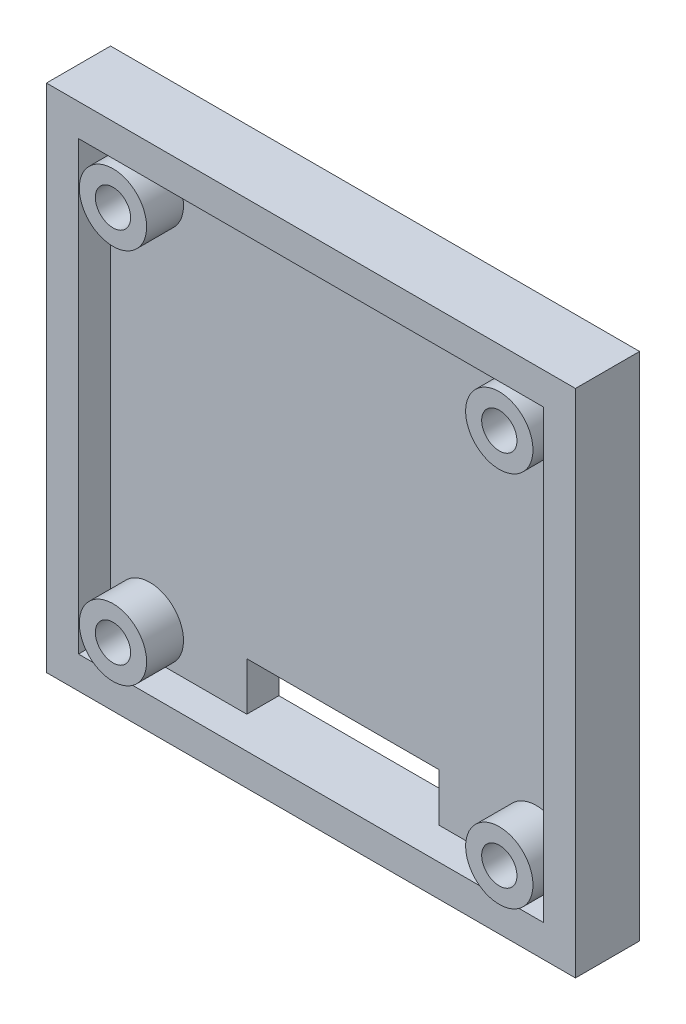
from build123d import *

# Parameters (mm, degrees)
SKETCH1_W           = 33
SKETCH1_H           = 31.85
SKETCH1_R           = 1.1
SKETCH1_W_2         = 12
SKETCH1_H_2         = 3
BOSS_EXTRUDE1_DEPTH = 2
SKETCH2_R           = 2.1
SKETCH2_R_2         = 1.1
BOSS_EXTRUDE2_DEPTH = 2.3
SKETCH3_W           = 33
SKETCH3_H           = 31.85
SKETCH3_W_2         = 29
SKETCH3_H_2         = 27.85
BOSS_EXTRUDE3_DEPTH = 2


with BuildPart() as part:
    # Sketch1 → Boss-Extrude1 (new body)
    with BuildSketch(Plane.XY):
        Rectangle(SKETCH1_W, SKETCH1_H)
        with Locations((-12.05, 11.575)):
            Circle(SKETCH1_R, mode=Mode.SUBTRACT)
        with Locations((12.05, 11.575)):
            Circle(SKETCH1_R, mode=Mode.SUBTRACT)
        with Locations((-12.05, -11.925)):
            Circle(SKETCH1_R, mode=Mode.SUBTRACT)
        with Locations((12.05, -11.925)):
            Circle(SKETCH1_R, mode=Mode.SUBTRACT)
        with Locations((0, -12.425)):
            Rectangle(SKETCH1_W_2, SKETCH1_H_2, mode=Mode.SUBTRACT)
    extrude(amount=BOSS_EXTRUDE1_DEPTH)

    # Sketch2 → Boss-Extrude2 (add)
    # profile 1 of 4: a face of its own
    with BuildSketch(Plane.XY.offset(2)):
        with Locations((-12.05, 11.575)):
            Circle(SKETCH2_R)
        with Locations((-12.05, 11.575)):
            Circle(SKETCH2_R_2, mode=Mode.SUBTRACT)
    # profile 2 of 4: a face of its own
    with BuildSketch(Plane.XY.offset(2)):
        with Locations((-12.05, -11.925)):
            Circle(SKETCH2_R)
        with Locations((-12.05, -11.925)):
            Circle(SKETCH2_R_2, mode=Mode.SUBTRACT)
    # profile 3 of 4: a face of its own
    with BuildSketch(Plane.XY.offset(2)):
        with Locations((12.05, -11.925)):
            Circle(SKETCH2_R)
        with Locations((12.05, -11.925)):
            Circle(SKETCH2_R_2, mode=Mode.SUBTRACT)
    # profile 4 of 4: a face of its own
    with BuildSketch(Plane.XY.offset(2)):
        with Locations((12.05, 11.575)):
            Circle(SKETCH2_R)
        with Locations((12.05, 11.575)):
            Circle(SKETCH2_R_2, mode=Mode.SUBTRACT)
    extrude(amount=BOSS_EXTRUDE2_DEPTH)

    # Sketch3 → Boss-Extrude3 (add)
    with BuildSketch(Plane.XY.offset(2)):
        Rectangle(SKETCH3_W, SKETCH3_H)
        Rectangle(SKETCH3_W_2, SKETCH3_H_2, mode=Mode.SUBTRACT)
    extrude(amount=BOSS_EXTRUDE3_DEPTH)


solid = part.part
